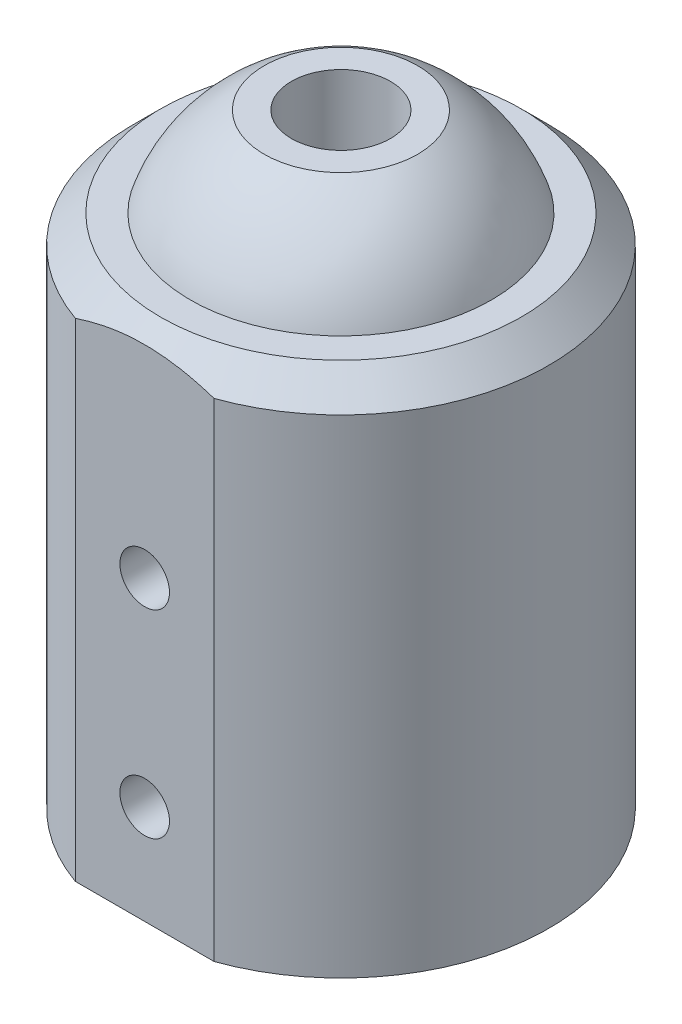
from build123d import *

# Parameters (mm, degrees)
SKETCH_2_R          = 2.5
CUT_EXTRUDE_1_DEPTH = 5
CUT_EXTRUDE_START   = 45
CUT_EXTRUDE_2_DEPTH = 45
SKETCH_4_R          = 1.25
CUT_EXTRUDE_3_DEPTH = 10


with BuildPart() as part:
    # 草图1 → 旋转1 (revolve)
    with BuildSketch(Plane.XY, mode=Mode.PRIVATE) as revolve_1_sk:
        with BuildLine():
            Line((0, 0), (10.5, 0))
            Line((10.5, 0), (10.5, 24.599342077))
            Line((10.5, 24.599342077), (9.099342077, 26))
            Line((9.099342077, 26), (7.599342077, 26))
            ThreePointArc((7.599342077, 26), (6.161660706, 28.602346259), (3.872983346, 30.5))
            Line((3.872983346, 30.5), (0, 30.5))
            Line((0, 30.5), (0, 0))
        make_face()
    revolve(revolve_1_sk.sketch.rotate(Axis((0, 33.582842794, 0), (0, -1, 0)), 90), axis=Axis((0, 33.582842794, 0), (0, -1, 0)))

    # 草图2 → 切除-拉伸1 (cut)
    with BuildSketch(Plane(origin=(0, 30.5, 0), x_dir=(1, 0, 0), z_dir=(0, 1, 0))):
        with Locations(Location((0, 0, 0), (0, 0, 270))):
            Circle(SKETCH_2_R)
    extrude(amount=-CUT_EXTRUDE_1_DEPTH, mode=Mode.SUBTRACT)

    # 草图3 → 切除-拉伸2 (cut)
    with BuildSketch(Plane(origin=(0, 0, 0), x_dir=(1, 0, 0), z_dir=(0, 1, 0)).offset(CUT_EXTRUDE_START)):
        with BuildLine():
            Line((-3.498571137, -9.9), (3.498571137, -9.9))
            ThreePointArc((3.498571137, -9.9), (0, -10.5), (-3.498571137, -9.9))
        make_face()
    extrude(amount=-CUT_EXTRUDE_2_DEPTH, mode=Mode.SUBTRACT)

    # 草图4 → 切除-拉伸3 (cut)
    with BuildSketch(Plane.XY.offset(9.9)):
        with Locations((0, 5)):
            Circle(SKETCH_4_R)
        with Locations((0, 15)):
            Circle(SKETCH_4_R)
    extrude(amount=-CUT_EXTRUDE_3_DEPTH, mode=Mode.SUBTRACT)


solid = part.part
